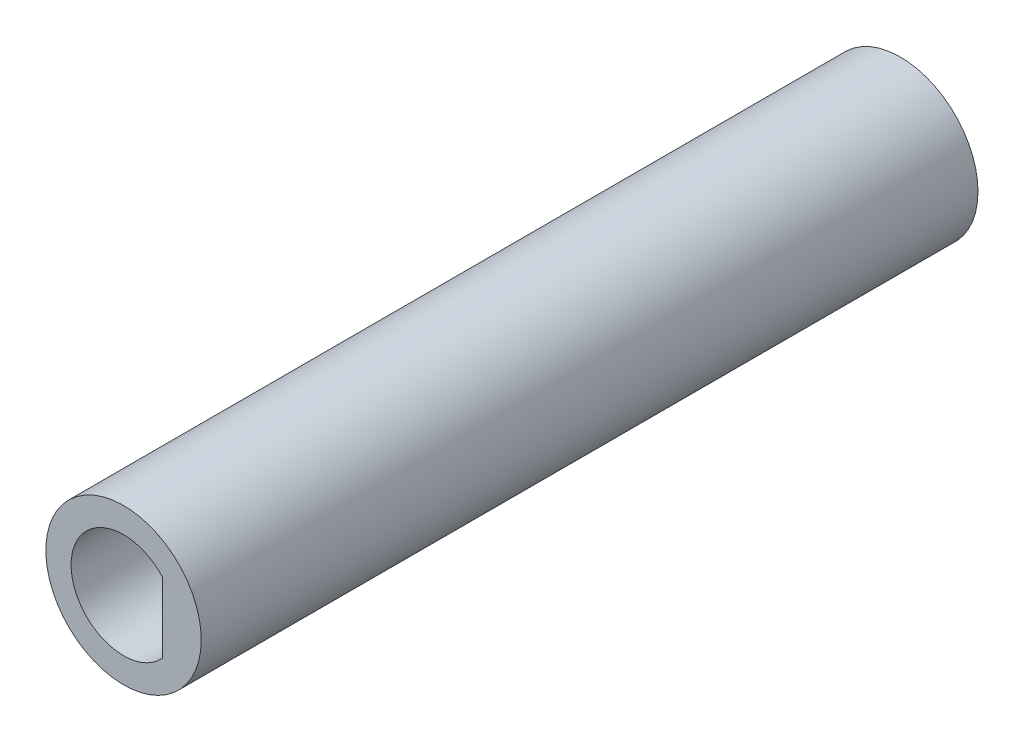
from build123d import *

# Parameters (mm, degrees)
SKETCH1_R           = 6
BOSS_EXTRUDE1_DEPTH = 15
BOSS_EXTRUDE2_START = -45
SKETCH2_R           = 6
BOSS_EXTRUDE2_DEPTH = 45


with BuildPart() as part:
    # Sketch1 → Boss-Extrude1 (new body)
    with BuildSketch(Plane.XY):
        Circle(SKETCH1_R)
        with BuildLine():
            Line((3, 2.720753572), (3, -2.720753572))
            ThreePointArc((3, -2.720753572), (-4.05, 0), (3, 2.720753572))
        make_face(mode=Mode.SUBTRACT)
    extrude(amount=BOSS_EXTRUDE1_DEPTH)

    # Sketch2 → Boss-Extrude2 (add)
    with BuildSketch(Plane.XY.offset(BOSS_EXTRUDE2_START)):
        Circle(SKETCH2_R)
    extrude(amount=BOSS_EXTRUDE2_DEPTH)


solid = part.part
